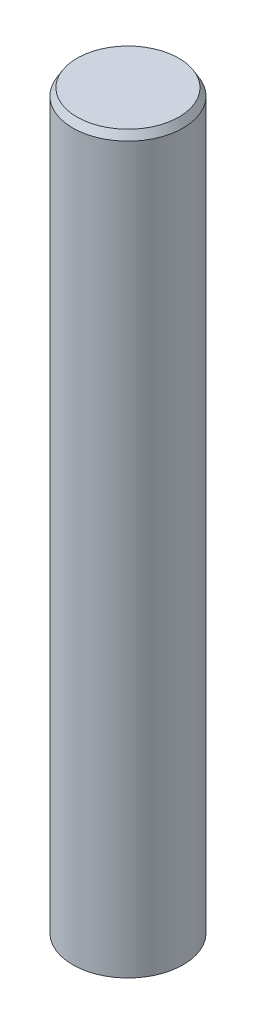
from build123d import *
from OCP.BRepFilletAPI import BRepFilletAPI_MakeChamfer

# Parameters (mm, degrees)
SKETCH1_R           = 1.5
BOSS_EXTRUDE1_DEPTH = 20
CHAMFER1_SIZE       = 0.2
CHAMFER1_SIZE2      = 0.115470054


with BuildPart() as part:
    # Sketch1 → Boss-Extrude1 (new body)
    with BuildSketch(Plane(origin=(0, 0, 0), x_dir=(1, 0, 0), z_dir=(0, 1, 0))):
        with Locations(Location((0, 0, 0), (0, 0, 270))):
            Circle(SKETCH1_R)
    extrude(amount=BOSS_EXTRUDE1_DEPTH)

    # Chamfer1: one chamfer whose edges measure the first distance from different faces: ONE call of the kernel's chamfer builder (chamfer() names one face for all edges)
    chamfer1_edges_1 = [part.edges().sort_by_distance(p)[0] for p in [
        (0, 0, -1.5),
    ]]
    chamfer1_side_1 = [part.faces().sort_by_distance(p)[0] for p in [
        (0, 0, 0),
    ]]
    chamfer1_edges_2 = [part.edges().sort_by_distance(p)[0] for p in [
        (0, 20, -1.5),
    ]]
    chamfer1_side_2 = [part.faces().sort_by_distance(p)[0] for p in [
        (0, 10, -1.5),
    ]]
    chamfer1 = BRepFilletAPI_MakeChamfer(part.part.solid().wrapped)
    for e in chamfer1_edges_1:
        chamfer1.Add(CHAMFER1_SIZE, CHAMFER1_SIZE2, e.wrapped, chamfer1_side_1[0].wrapped)  # the first distance lies on this face
    for e in chamfer1_edges_2:
        chamfer1.Add(CHAMFER1_SIZE, CHAMFER1_SIZE2, e.wrapped, chamfer1_side_2[0].wrapped)  # the first distance lies on this face
    add(Compound.cast(chamfer1.Shape()), mode=Mode.REPLACE)


solid = part.part
